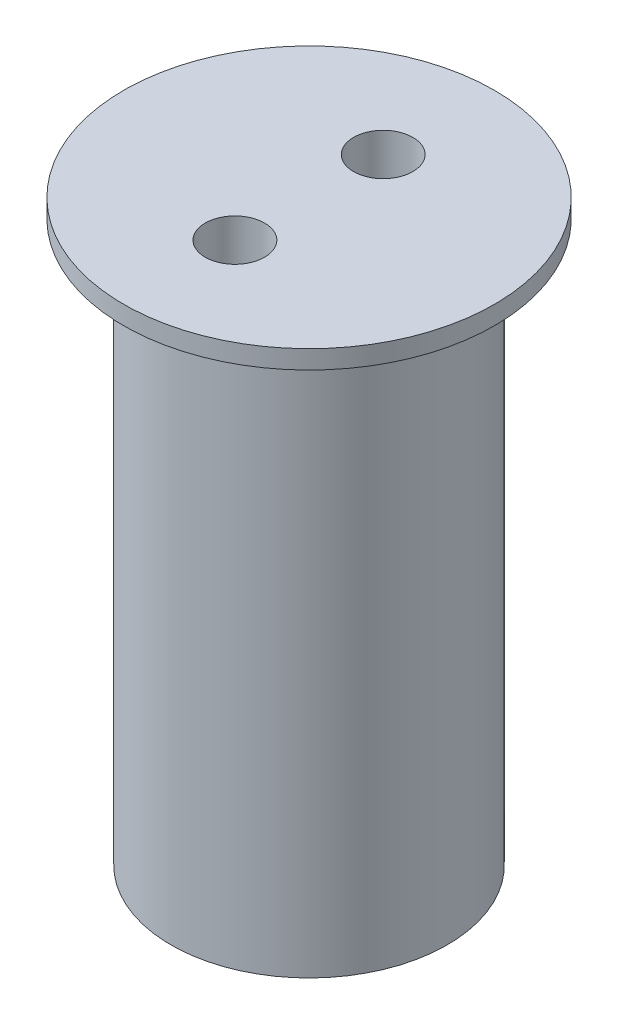
from build123d import *

# Parameters (mm, degrees)
SKETCH_2_R          = 1.6
CUT_EXTRUDE_1_DEPTH = 36


with BuildPart() as part:
    # 草图1 → 旋转1 (revolve)
    with BuildSketch(Plane.XY, mode=Mode.PRIVATE) as revolve_1_sk:
        Polygon((0, 14.96953125), (10, 14.96953125), (10, 13.96953125), (7.45, 13.96953125), (7.45, -16.23046875), (0, -16.23046875), align=None)
    revolve(revolve_1_sk.sketch.rotate(Axis((0, -16.23046875, 0), (0, 1, 0)), 90), axis=Axis((0, -16.23046875, 0), (0, 1, 0)))

    # 草图2 → 切除-拉伸1 (cut)
    with BuildSketch(Plane.XZ.offset(16.23046875)):
        with Locations(Location((0, 4, 0), (0, 0, 270))):
            Circle(SKETCH_2_R)
        with Locations(Location((0, -4, 0), (0, 0, 270))):
            Circle(SKETCH_2_R)
    extrude(amount=-CUT_EXTRUDE_1_DEPTH, mode=Mode.SUBTRACT)


solid = part.part
